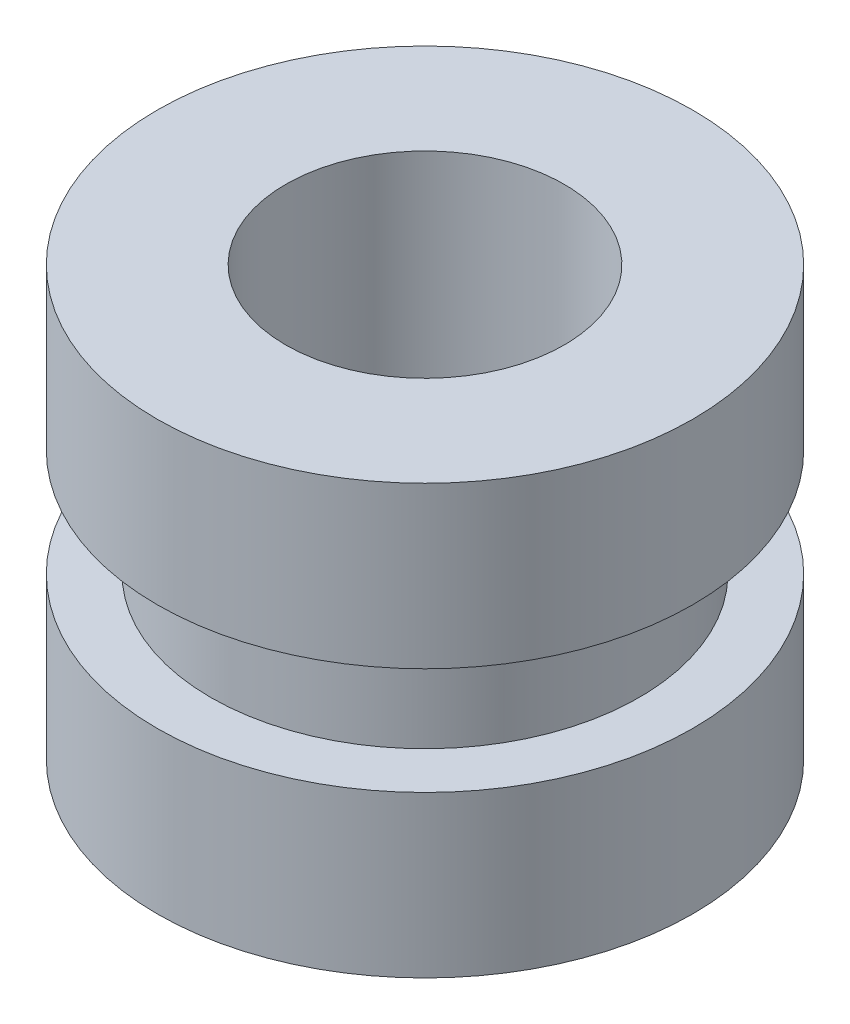
from build123d import *

# Parameters (mm, degrees)
SKETCH1_R           = 2
SKETCH1_R_2         = 1.3
BOSS_EXTRUDE1_DEPTH = 0.5
SKETCH2_R           = 2.5
SKETCH2_R_2         = 1.3
BOSS_EXTRUDE2_DEPTH = 1.5


with BuildPart() as part:
    # Sketch1 → Boss-Extrude1 (new, symmetric)
    with BuildSketch(Plane(origin=(0, 0, 0), x_dir=(1, 0, 0), z_dir=(0, 1, 0))):
        with Locations(Location((0, 0, 0), (0, 0, 270))):
            Circle(SKETCH1_R)
        with Locations(Location((0, 0, 0), (0, 0, 270))):
            Circle(SKETCH1_R_2, mode=Mode.SUBTRACT)
    extrude(amount=BOSS_EXTRUDE1_DEPTH, both=True)

    # Sketch2 → Boss-Extrude2 (add)
    with BuildSketch(Plane(origin=(0, 0.5, 0), x_dir=(1, 0, 0), z_dir=(0, 1, 0))):
        with Locations(Location((0, 0, 0), (0, 0, 270))):
            Circle(SKETCH2_R)
        with Locations(Location((0, 0, 0), (0, 0, 270))):
            Circle(SKETCH2_R_2, mode=Mode.SUBTRACT)
    boss_extrude2 = extrude(amount=BOSS_EXTRUDE2_DEPTH)

    # Mirror1: Boss-Extrude2 across plane
    add(boss_extrude2.mirror(Plane.ZX))


solid = part.part
